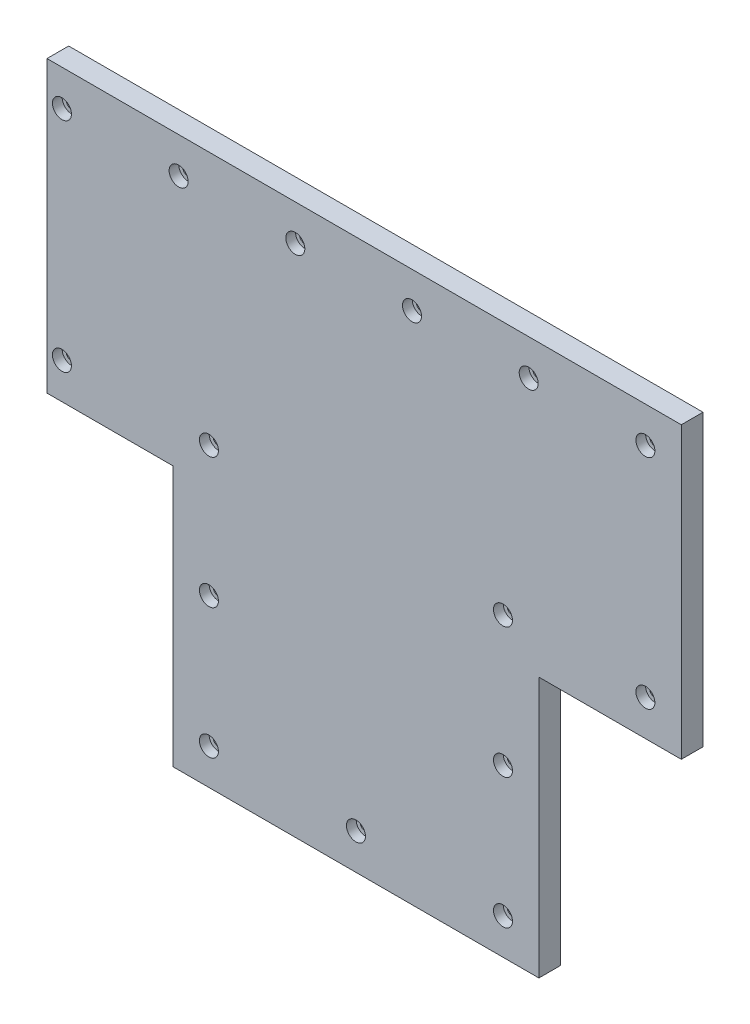
from build123d import *

# Parameters (mm, degrees)
BOSS_EXTRUDE1_DEPTH                            = 6.35
CBORE_FOR_4_SOCKET_HEAD_CAP_SCREW1_D           = 3.2639
CBORE_FOR_4_SOCKET_HEAD_CAP_SCREW1_CBORE_D     = 5.55752
CBORE_FOR_4_SOCKET_HEAD_CAP_SCREW1_CBORE_DEPTH = 2.8448
BOSS_EXTRUDE2_DEPTH                            = 2
BOSS_EXTRUDE3_DEPTH                            = 6.35
CUT_EXTRUDE1_DEPTH                             = 3


with BuildPart() as part:
    # Outline → Boss-Extrude1 (new body)
    with BuildSketch(Plane.XY):
        Polygon((10, -63.74011537), (52.353553391, -63.74011537), (52.353553391, -139.94011537), (148.353553391, -139.94011537), (148.353553391, -63.74011537), (190, -63.74011537), (190, 10), (10, 10), align=None)
    extrude(amount=BOSS_EXTRUDE1_DEPTH)

    # CBORE for #4 Socket Head Cap Screw1 (through all)
    with Locations(Plane(origin=(14.3688, 5, 6.35), x_dir=(1, 0, 0), z_dir=(0, 0, 1))):
        with Locations((0, 0), (0, -63.74011537), (42.984753391, -63.74011537), (34.12624, 0), (68.25248, 0), (102.37872, 0), (136.50496, 0), (128.984753391, -63.74011537), (128.984753391, -101.84011537), (42.984753391, -139.94011537), (42.984753391, -101.84011537), (170.6312, -63.74011537), (170.6312, 0), (85.984753391, -139.94011537), (128.984753391, -139.94011537)):
            CounterBoreHole(CBORE_FOR_4_SOCKET_HEAD_CAP_SCREW1_D / 2, CBORE_FOR_4_SOCKET_HEAD_CAP_SCREW1_CBORE_D / 2, CBORE_FOR_4_SOCKET_HEAD_CAP_SCREW1_CBORE_DEPTH)

    # Outline<10> → Boss-Extrude2 (add)
    with BuildSketch(Plane.XY):
        Polygon((128.637824638, -53.74011537), (78.433243174, -3.535533906), (81.96877708, 0), (132.173358544, -50.204581464), align=None)
        Polygon((118.738329701, -53.74011537), (122.273863607, -50.204581464), (72.069282143, 0), (68.533748237, -3.535533906), align=None)
    extrude(amount=-BOSS_EXTRUDE2_DEPTH)

    # Sketch8 → Boss-Extrude3 (add)
    with BuildSketch(Plane.XY):
        Polygon((10, 10), (190, 10), (190, -63.74011537), (148.353553391, -63.74011537), (148.353553391, -139.94011537), (52.353553391, -139.94011537), (52.353553391, -63.74011537), (10, -63.74011537), (10, -69.24011537), (46.853553391, -69.24011537), (46.853553391, -145.44011537), (153.853553391, -145.44011537), (153.853553391, -69.24011537), (195.5, -69.24011537), (195.5, 15.5), (10, 15.5), align=None)
    extrude(amount=BOSS_EXTRUDE3_DEPTH)

    # Sketch8<5> → Cut-Extrude1 (cut)
    with BuildSketch(Plane.XY):
        Polygon((190, 10), (0, 10), (0, 13.5), (193.5, 13.5), (193.5, -67.24011537), (151.853553391, -67.24011537), (151.853553391, -143.44011537), (48.853553391, -143.44011537), (48.853553391, -67.24011537), (0, -67.24011537), (0, -63.74011537), (52.353553391, -63.74011537), (52.353553391, -139.94011537), (148.353553391, -139.94011537), (148.353553391, -63.74011537), (190, -63.74011537), align=None)
        Polygon((52.853553391, -63.24011537), (0, -63.24011537), (0, -63.74011537), (52.353553391, -63.74011537), (52.353553391, -139.94011537), (148.353553391, -139.94011537), (148.353553391, -63.74011537), (190, -63.74011537), (190, 10), (0, 10), (0, 9.5), (189.5, 9.5), (189.5, -63.24011537), (147.853553391, -63.24011537), (147.853553391, -139.44011537), (52.853553391, -139.44011537), align=None)
    extrude(amount=CUT_EXTRUDE1_DEPTH, mode=Mode.SUBTRACT)


solid = part.part
